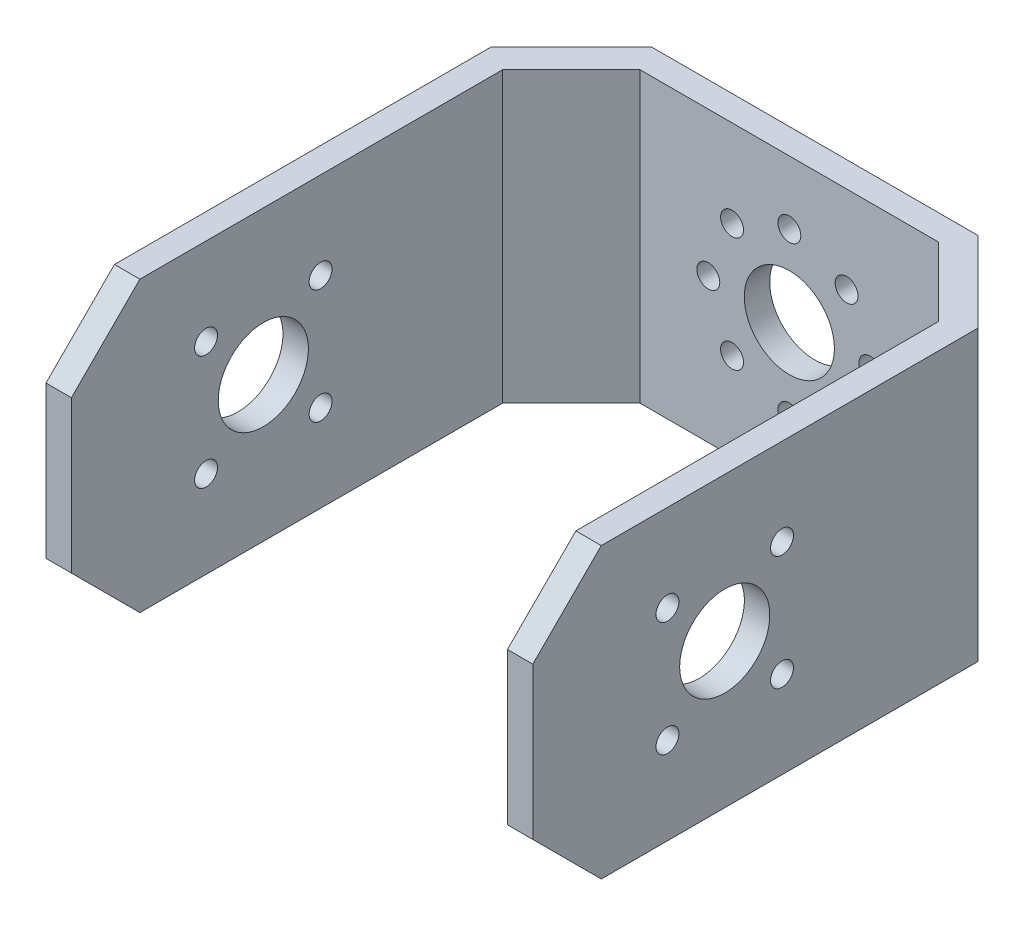
from build123d import *

# Parameters (mm, degrees)
BOSS_EXTRUDE1_DEPTH = 12.605
CUT_EXTRUDE1_DEPTH  = 32.2
SKETCH3_R           = 3.935
SKETCH3_R_2         = 1
CUT_EXTRUDE2_DEPTH  = 32.2
SKETCH4_R           = 3.935
SKETCH4_R_2         = 1
CUT_EXTRUDE3_DEPTH  = 32.2
CHAMFER1_SIZE       = 6
CHAMFER2_SIZE       = 7


with BuildPart() as part:
    # Sketch1 → Boss-Extrude1 (new, symmetric)
    with BuildSketch(Plane(origin=(0, 0, 0), x_dir=(1, 0, 0), z_dir=(0, 1, 0))):
        Polygon((0, 0), (-21.25, 0), (-21.25, -45.86), (-19.03, -45.86), (-19.03, -2.22), (0, -2.22), align=None)
    boss_extrude1 = extrude(amount=BOSS_EXTRUDE1_DEPTH, both=True)

    # Sketch2 → Cut-Extrude1 (cut)
    with BuildSketch(Plane.ZY.offset(21.25)):
        Polygon((39.885, 12.605), (45.86, 6.63), (45.86, 12.605), align=None)
        Polygon((45.86, -6.63), (39.885, -12.605), (45.86, -12.605), align=None)
    cut_extrude1 = extrude(amount=-CUT_EXTRUDE1_DEPTH, mode=Mode.SUBTRACT)

    # Sketch3 → Cut-Extrude2 (cut)
    with BuildSketch(Plane.ZY.offset(21.25)):
        with Locations((29.11, 0)):
            Circle(SKETCH3_R)
        with Locations((24.11, 5)):
            Circle(SKETCH3_R_2)
        with Locations((34.11, 5)):
            Circle(SKETCH3_R_2)
        with Locations((34.11, -5)):
            Circle(SKETCH3_R_2)
        with Locations((24.11, -5)):
            Circle(SKETCH3_R_2)
    cut_extrude2 = extrude(amount=-CUT_EXTRUDE2_DEPTH, mode=Mode.SUBTRACT)

    # Mirror1: Boss-Extrude1, Cut-Extrude1, Cut-Extrude2 across plane
    add(boss_extrude1.mirror(Plane(origin=(0, 12.605, 2.22), x_dir=(0, 0, 1), z_dir=(-1, 0, 0))))
    add(cut_extrude1.mirror(Plane(origin=(0, 12.605, 2.22), x_dir=(0, 0, 1), z_dir=(-1, 0, 0))), mode=Mode.SUBTRACT)
    add(cut_extrude2.mirror(Plane(origin=(0, 12.605, 2.22), x_dir=(0, 0, 1), z_dir=(-1, 0, 0))), mode=Mode.SUBTRACT)

    # Sketch4 → Cut-Extrude3 (cut)
    with BuildSketch(Plane.XY.offset(2.22)):
        Circle(SKETCH4_R)
        with Locations((-5, 5)):
            Circle(SKETCH4_R_2)
        with Locations((5, 5)):
            Circle(SKETCH4_R_2)
        with Locations((5, -5)):
            Circle(SKETCH4_R_2)
        with Locations((-5, -5)):
            Circle(SKETCH4_R_2)
        with Locations((-7.071067812, 0)):
            Circle(SKETCH4_R_2)
        with Locations((0, 7.071067812)):
            Circle(SKETCH4_R_2)
        with Locations((7.071067812, 0)):
            Circle(SKETCH4_R_2)
        with Locations((0, -7.071067812)):
            Circle(SKETCH4_R_2)
    extrude(amount=-CUT_EXTRUDE3_DEPTH, mode=Mode.SUBTRACT)

    # Chamfer1
    chamfer1_edges = [part.edges().sort_by_distance(p)[0] for p in [
        (-19.03, 0, 2.22),
        (19.03, 0, 2.22),
    ]]
    chamfer(chamfer1_edges, length=CHAMFER1_SIZE)

    # Chamfer2
    chamfer2_edges = [part.edges().sort_by_distance(p)[0] for p in [
        (-21.25, 0, 0),
        (21.25, 0, 0),
    ]]
    chamfer(chamfer2_edges, length=CHAMFER2_SIZE)


solid = part.part
